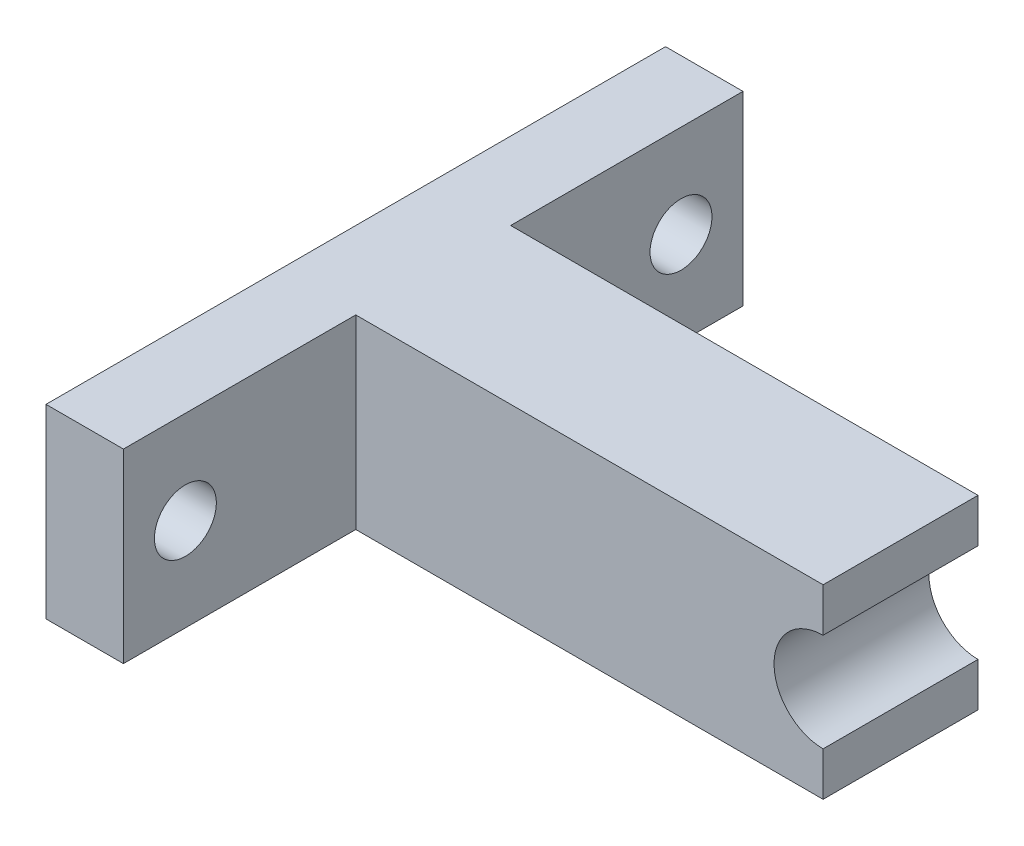
from build123d import *

# Parameters (mm, degrees)
SKETCH1_W           = 40
SKETCH1_H           = 12
SKETCH1_R           = 2
BOSS_EXTRUDE1_DEPTH = 5
SKETCH2_W           = 30.175
SKETCH2_H           = 10
BOSS_EXTRUDE2_DEPTH = 6
SKETCH3_R           = 3.175
CUT_EXTRUDE1_DEPTH  = 17


with BuildPart() as part:
    # Sketch1 → Boss-Extrude1 (new body)
    with BuildSketch(Plane(origin=(0, 0, 0), x_dir=(0, 0, -1), z_dir=(1, 0, 0))):
        Rectangle(SKETCH1_W, SKETCH1_H)
        with Locations((-16, 0)):
            Circle(SKETCH1_R, mode=Mode.SUBTRACT)
        with Locations(Location((16, 0, 0), (0, 0, 180))):
            Circle(SKETCH1_R, mode=Mode.SUBTRACT)
    extrude(amount=BOSS_EXTRUDE1_DEPTH)

    # Sketch2 → Boss-Extrude2 (add, symmetric)
    with BuildSketch(Plane(origin=(0, 0, 0), x_dir=(1, 0, 0), z_dir=(0, 1, 0))):
        with Locations((20.0875, 0)):
            Rectangle(SKETCH2_W, SKETCH2_H)
    extrude(amount=BOSS_EXTRUDE2_DEPTH, both=True)

    # Sketch3 → Cut-Extrude1 (cut, symmetric)
    with BuildSketch(Plane.XY):
        with Locations((35.18, 0)):
            Circle(SKETCH3_R)
    extrude(amount=CUT_EXTRUDE1_DEPTH, both=True, mode=Mode.SUBTRACT)


solid = part.part
